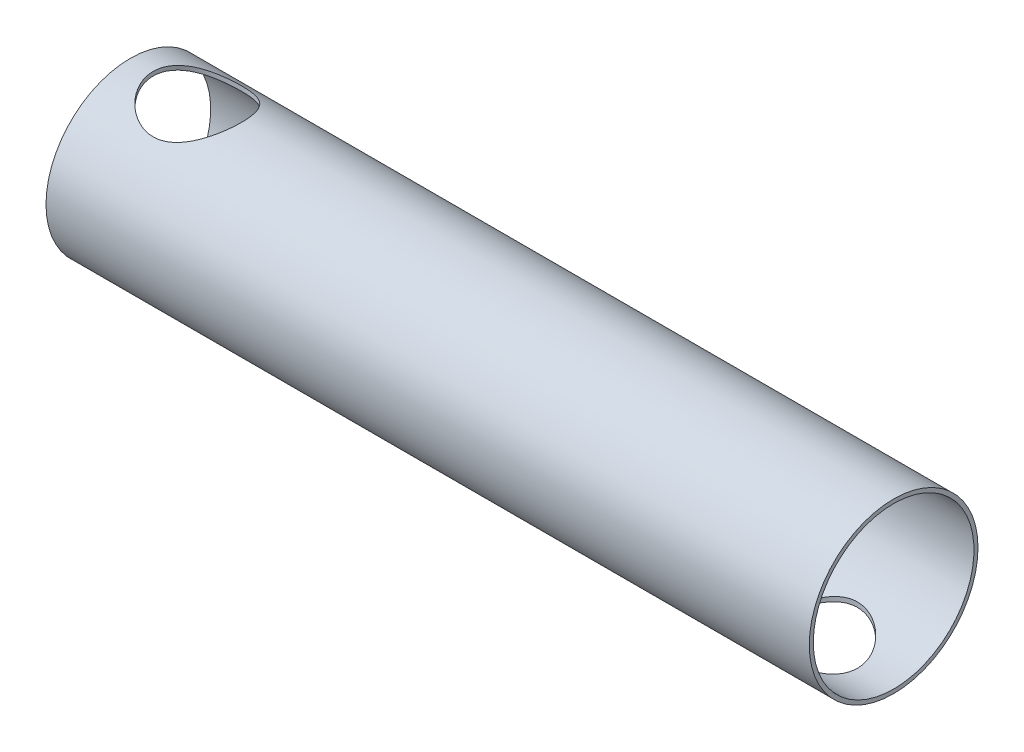
from build123d import *

# Parameters (mm, degrees)
SKETCH_1_W          = 2850
SKETCH_1_H          = 15
SKETCH_2_R          = 165
CUT_EXTRUDE_1_DEPTH = 2885.605692291
SKETCH_3_R          = 165
CUT_EXTRUDE_2_DEPTH = 2885.605692412


with BuildPart() as part:
    # Эскиз1 → Повернуть1 (revolve)
    with BuildSketch(Plane.XY, mode=Mode.PRIVATE) as revolve_1_sk:
        with Locations((1425, -307.5)):
            Rectangle(SKETCH_1_W, SKETCH_1_H)
    revolve(revolve_1_sk.sketch.rotate(Axis((0, 0, 0), (1, 0, 0)), 270), axis=Axis((0, 0, 0), (1, 0, 0)))

    # Эскиз2 → Вырез-Вытянуть1 (cut, through all)
    with BuildSketch(Plane(origin=(0, 0, 0), x_dir=(1, 0, 0), z_dir=(0, 1, 0))):
        with Locations(Location((250, 0, 0), (0, 0, 90))):
            Circle(SKETCH_2_R)
    extrude(amount=CUT_EXTRUDE_1_DEPTH, mode=Mode.SUBTRACT)

    # Эскиз3 → Вырез-Вытянуть2 (cut, through all)
    with BuildSketch(Plane(origin=(0, 0, 0), x_dir=(1, 0, 0), z_dir=(0, 1, 0))):
        with Locations(Location((2550, 0, 0), (0, 0, 270))):
            Circle(SKETCH_3_R)
    extrude(amount=-CUT_EXTRUDE_2_DEPTH, mode=Mode.SUBTRACT)


solid = part.part
